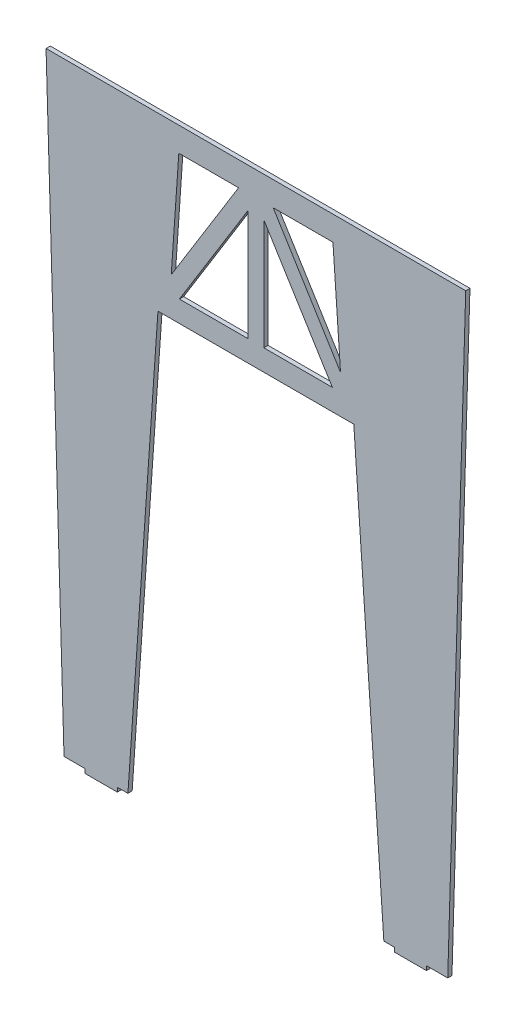
from build123d import *

# Parameters (mm, degrees)
BOSS_EXTRUDE1_DEPTH = 10.16


with BuildPart() as part:
    # Sketch1 → Boss-Extrude1 (new body)
    with BuildSketch(Plane.XY):
        Polygon((-502.783260533, 1465.163333881), (-459.721789204, 17.476365817), (-408.921789204, 17.476365817), (-408.921789204, 7.316365817), (-332.100796745, 7.316365817), (-332.100796745, 17.476365817), (-306.627827519, 17.476365817), (-234.627172097, 1054.1), (234.627172097, 1054.1), (306.627827519, 17.476365817), (332.721789204, 17.476365817), (332.721789204, 7.316365817), (408.921789204, 7.316365817), (408.921789204, 17.476365817), (459.721789204, 17.476365817), (502.783260533, 1465.163333881), align=None)
        Polygon((-202.80261453, 1145.716008632), (-184.672467887, 1406.743333881), (-41.445883295, 1406.743333881), align=None, mode=Mode.SUBTRACT)
        Polygon((-19.05, 1104.9), (-183.241684323, 1104.9), (-19.05, 1370.513438368), align=None, mode=Mode.SUBTRACT)
        Polygon((183.241684323, 1104.9), (19.05, 1104.9), (19.05, 1370.513438368), align=None, mode=Mode.SUBTRACT)
        Polygon((184.672467887, 1406.743333881), (202.80261453, 1145.716008632), (41.445883295, 1406.743333881), align=None, mode=Mode.SUBTRACT)
    extrude(amount=BOSS_EXTRUDE1_DEPTH)


solid = part.part
